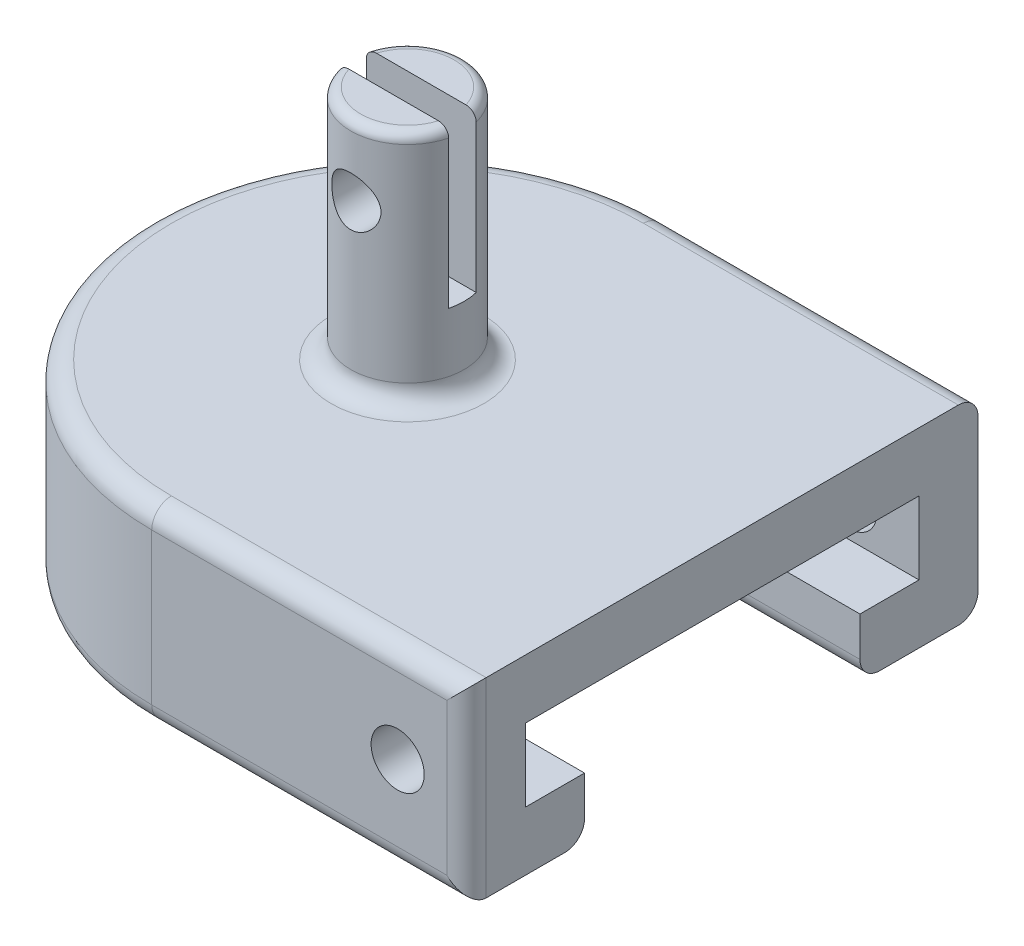
from build123d import *

# Parameters (mm, degrees)
BOSS_EXTRUDE1_DEPTH   = 3
BOSS_EXTRUDE2_DEPTH   = 3.7
BOSS_EXTRUDE3_DEPTH   = 3
SKETCH4_R             = 2.88
BOSS_EXTRUDE4_DEPTH   = 12
F_2_5MM_DOWEL_HOLE1_D = 2.5
SKETCH8_R             = 1.35
CUT_EXTRUDE1_DEPTH    = 38.455173265
FILLET1_R             = 1
FILLET2_R             = 1
CUT_EXTRUDE2_START    = -8
CUT_EXTRUDE2_DEPTH    = 8
FILLET3_R             = 0.5


with BuildPart() as part:
    # Sketch1 → Boss-Extrude1 (new body)
    with BuildSketch(Plane(origin=(0, 0, 0), x_dir=(1, 0, 0), z_dir=(0, 1, 0))):
        with BuildLine():
            Line((0, 13), (16, 13))
            Line((16, 13), (16, 7))
            Line((16, 7), (0, 7))
            ThreePointArc((0, 7), (-7, 0), (0, -7))
            Line((0, -7), (16, -7))
            Line((16, -7), (16, -13))
            Line((16, -13), (0, -13))
            ThreePointArc((0, -13), (-13, 0), (0, 13))
        make_face()
    extrude(amount=BOSS_EXTRUDE1_DEPTH)

    # Sketch2 → Boss-Extrude2 (add)
    with BuildSketch(Plane(origin=(0, 3, 0), x_dir=(1, 0, 0), z_dir=(0, 1, 0))):
        with BuildLine():
            Line((0, 13), (16, 13))
            Line((16, 13), (16, 10))
            Line((16, 10), (0, 10))
            ThreePointArc((0, 10), (-10, 0), (0, -10))
            Line((0, -10), (16, -10))
            Line((16, -10), (16, -13))
            Line((16, -13), (0, -13))
            ThreePointArc((0, -13), (-13, 0), (0, 13))
        make_face()
    extrude(amount=BOSS_EXTRUDE2_DEPTH)

    # Sketch3 → Boss-Extrude3 (add)
    with BuildSketch(Plane(origin=(0, 6.7, 0), x_dir=(1, 0, 0), z_dir=(0, 1, 0))):
        with BuildLine():
            Line((16, 13), (0, 13))
            ThreePointArc((0, 13), (-13, 0), (0, -13))
            Line((0, -13), (16, -13))
            Line((16, -13), (16, -7))
            Line((16, -7), (16, 7))
            Line((16, 7), (16, 13))
        make_face()
    extrude(amount=BOSS_EXTRUDE3_DEPTH)

    # Sketch4 → Boss-Extrude4 (add)
    with BuildSketch(Plane(origin=(0, 9.7, 0), x_dir=(1, 0, 0), z_dir=(0, 1, 0))):
        with Locations(Location((0, 0, 0), (0, 0, 270))):
            Circle(SKETCH4_R)
    extrude(amount=BOSS_EXTRUDE4_DEPTH)

    # Ø2.5mm Dowel Hole1 (through all)
    with Locations(Plane(origin=(-0.002429038, 18.104937254, 2.879998976), x_dir=(0.999999644325, 0, 0.000843415861), z_dir=(-0.000843415861, 0, 0.999999644325))):
        with Locations((0, 0)):
            Hole(F_2_5MM_DOWEL_HOLE1_D / 2)

    # Sketch8 → Cut-Extrude1 (cut, through all)
    with BuildSketch(Plane.XY.offset(13)):
        with Locations((12.5, 4.85)):
            Circle(SKETCH8_R)
    extrude(amount=-CUT_EXTRUDE1_DEPTH, mode=Mode.SUBTRACT)

    # Fillet1
    fillet1_edges = [part.edges().sort_by_distance(p)[0] for p in [
        (8, 0, -13),
        (8, 0, -7),
        (-7, 0, 0),
        (16, 4.85, 13),
        (-13, 9.7, 0),
        (8, 9.7, 13),
        (8, 9.7, -13),
        (8, 0, 7),
        (8, 0, 13),
        (-13, 0, 0),
    ]]
    fillet(fillet1_edges, radius=FILLET1_R)

    # Fillet2
    fillet2_edges = [part.edges().sort_by_distance(p)[0] for p in [
        (0, 9.7, -2.88),
    ]]
    fillet(fillet2_edges, radius=FILLET2_R)

    # Sketch10 → Cut-Extrude2 (cut)
    with BuildSketch(Plane(origin=(0, 21.7, 0), x_dir=(1, 0, 0), z_dir=(0, 1, 0)).offset(CUT_EXTRUDE2_START)):
        with BuildLine():
            Line((-2.793635624, 0.7), (2.793635624, 0.7))
            ThreePointArc((2.793635624, 0.7), (2.88, 0), (2.793635624, -0.7))
            Line((2.793635624, -0.7), (-2.793635624, -0.7))
            ThreePointArc((-2.793635624, -0.7), (-2.88, 0), (-2.793635624, 0.7))
        make_face()
    extrude(amount=CUT_EXTRUDE2_DEPTH, mode=Mode.SUBTRACT)

    # Fillet3
    fillet3_edges = [part.edges().sort_by_distance(p)[0] for p in [
        (0, 21.7, -2.88),
        (1.771778767, 21.7, 2.270506551),
    ]]
    fillet(fillet3_edges, radius=FILLET3_R)


solid = part.part
